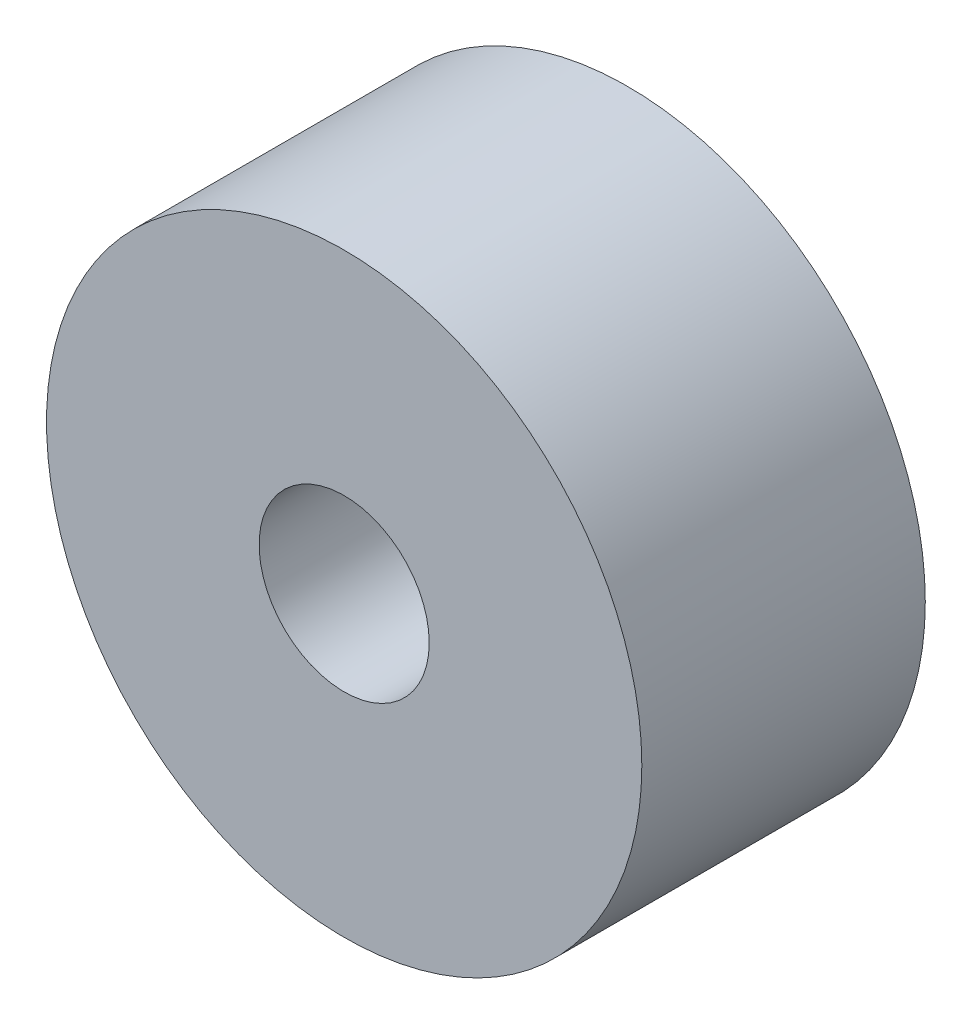
from build123d import *

# Parameters (mm, degrees)
SKETCH1_R           = 21
SKETCH1_R_2         = 6
BOSS_EXTRUDE1_DEPTH = 10


with BuildPart() as part:
    # Sketch1 → Boss-Extrude1 (new, symmetric)
    with BuildSketch(Plane.XY):
        Circle(SKETCH1_R)
        Circle(SKETCH1_R_2, mode=Mode.SUBTRACT)
    extrude(amount=BOSS_EXTRUDE1_DEPTH, both=True)


solid = part.part
